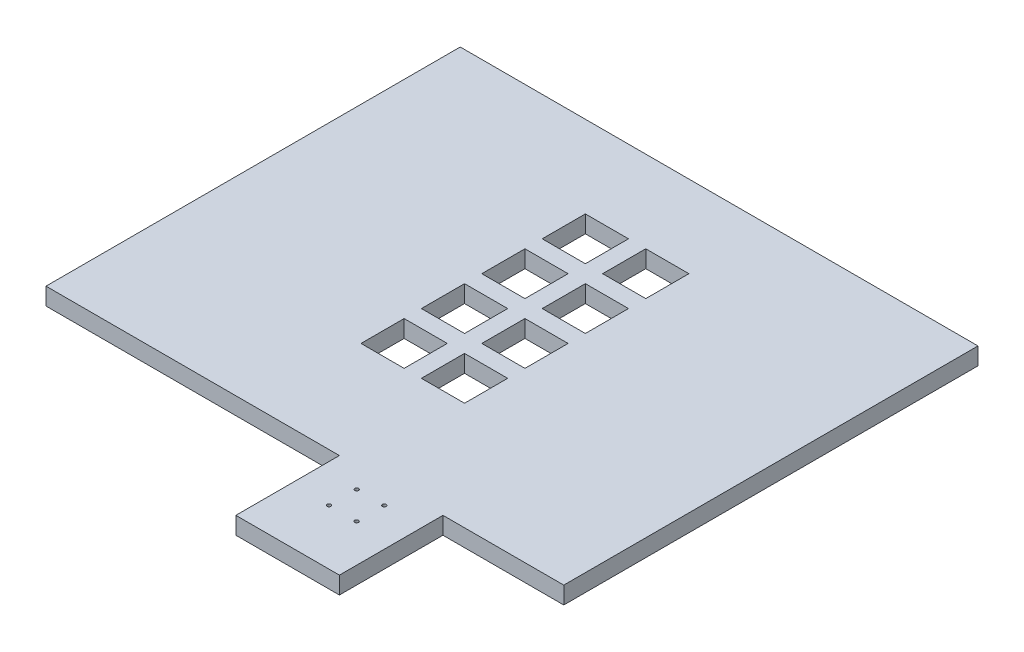
from build123d import *

# Parameters (mm, degrees)
EXTRUDE_1_DEPTH     = 10
SKETCH_2_W          = 25
SKETCH_2_H          = 25
SKETCH_2_R          = 1.1
CUT_EXTRUDE_1_DEPTH = 8
SKETCH_2_3_R        = 1.1
CUT_EXTRUDE_2_DEPTH = 235.520787991
SKETCH_3_W          = 25
SKETCH_3_H          = 25
CUT_EXTRUDE_3_DEPTH = 235.520787991
FILLET_2_R          = 2


with BuildPart() as part:
    # 草圖1 → 填料-伸長1 (new body)
    with BuildSketch(Plane(origin=(0, 0, 0), x_dir=(1, 0, 0), z_dir=(0, 1, 0))):
        Polygon((-150, -120), (20, -120), (20, -180), (80, -180), (80, -120), (150, -120), (150, 120), (-150, 120), align=None)
    extrude(amount=EXTRUDE_1_DEPTH)

    # 草圖2 → 除料-伸長1 (cut)
    with BuildSketch(Plane.XZ):
        with Locations((50, 140)):
            Rectangle(SKETCH_2_W, SKETCH_2_H)
        with Locations((42, 132)):
            Circle(SKETCH_2_R, mode=Mode.SUBTRACT)
        with Locations((58, 132)):
            Circle(SKETCH_2_R, mode=Mode.SUBTRACT)
        with Locations((42, 148)):
            Circle(SKETCH_2_R, mode=Mode.SUBTRACT)
        with Locations((58, 148)):
            Circle(SKETCH_2_R, mode=Mode.SUBTRACT)
    extrude(amount=-CUT_EXTRUDE_1_DEPTH, mode=Mode.SUBTRACT)

    # 草圖2<3> → 除料-伸長2 (cut, through all)
    with BuildSketch(Plane.XZ):
        with Locations((42, 132)):
            Circle(SKETCH_2_3_R)
        with Locations((42, 148)):
            Circle(SKETCH_2_3_R)
        with Locations((58, 132)):
            Circle(SKETCH_2_3_R)
        with Locations((58, 148)):
            Circle(SKETCH_2_3_R)
    extrude(amount=-CUT_EXTRUDE_2_DEPTH, mode=Mode.SUBTRACT)

    # 草圖3 → 除料-伸長3 (cut, through all)
    with BuildSketch(Plane(origin=(0, 10, 0), x_dir=(1, 0, 0), z_dir=(0, 1, 0))):
        with Locations((-17.5, 25)):
            Rectangle(SKETCH_3_W, SKETCH_3_H)
        with Locations((-17.5, -45)):
            Rectangle(SKETCH_3_W, SKETCH_3_H)
        with Locations((-17.5, 60)):
            Rectangle(SKETCH_3_W, SKETCH_3_H)
        with Locations((-17.5, -10)):
            Rectangle(SKETCH_3_W, SKETCH_3_H)
        with Locations((17.5, -45)):
            Rectangle(SKETCH_3_W, SKETCH_3_H)
        with Locations((17.5, -10)):
            Rectangle(SKETCH_3_W, SKETCH_3_H)
        with Locations((17.5, 25)):
            Rectangle(SKETCH_3_W, SKETCH_3_H)
        with Locations((17.5, 60)):
            Rectangle(SKETCH_3_W, SKETCH_3_H)
    extrude(amount=-CUT_EXTRUDE_3_DEPTH, mode=Mode.SUBTRACT)

    # 圓角2
    fillet_2_edges = [part.edges().sort_by_distance(p)[0] for p in [
        (37.5, 4, 152.5),
        (62.5, 4, 127.5),
        (62.5, 4, 152.5),
        (37.5, 4, 127.5),
    ]]
    fillet(fillet_2_edges, radius=FILLET_2_R)


solid = part.part
